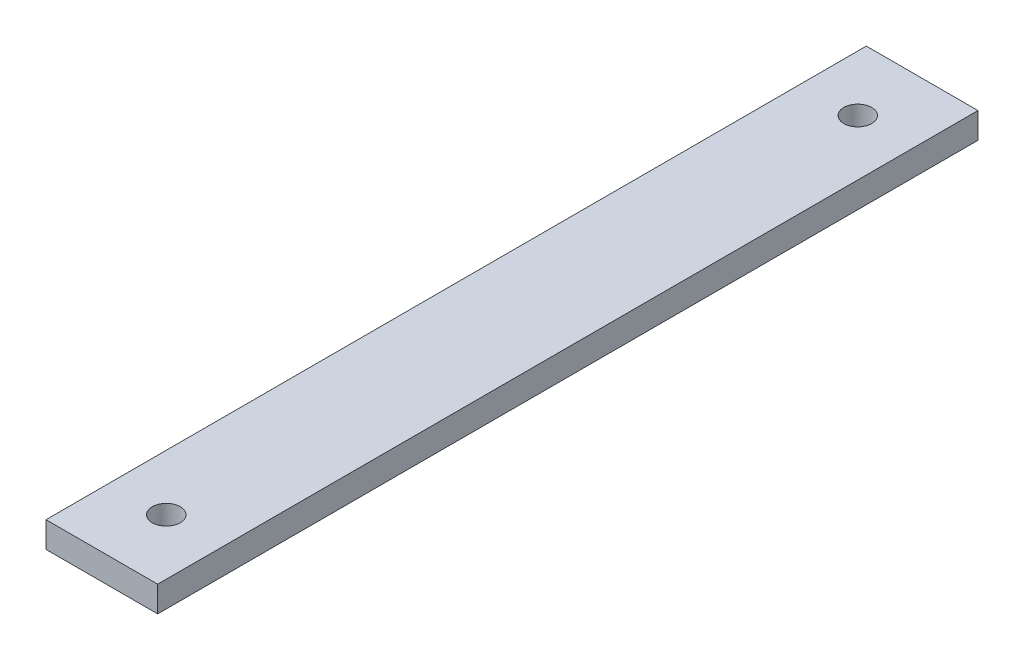
from build123d import *

# Parameters (mm, degrees)
SKETCH1_W           = 26
SKETCH1_H           = 191
BOSS_EXTRUDE1_DEPTH = 6
SKETCH2_R           = 3.25
CUT_EXTRUDE1_DEPTH  = 10


with BuildPart() as part:
    # Sketch1 → Boss-Extrude1 (new body)
    with BuildSketch(Plane(origin=(0, 0, 0), x_dir=(1, 0, 0), z_dir=(0, 1, 0))):
        with Locations((-63.236527651, -51.045128746)):
            Rectangle(SKETCH1_W, SKETCH1_H)
    extrude(amount=BOSS_EXTRUDE1_DEPTH)

    # Sketch2 → Cut-Extrude1 (cut)
    with BuildSketch(Plane(origin=(0, 0, 0), x_dir=(-1, 0, 0), z_dir=(0, -1, 0))):
        with Locations(Location((63.236527651, -131.545128746, 0), (0, 0, 90))):
            Circle(SKETCH2_R)
        with Locations(Location((63.236527651, 29.454871254, 0), (0, 0, 90))):
            Circle(SKETCH2_R)
    extrude(amount=-CUT_EXTRUDE1_DEPTH, mode=Mode.SUBTRACT)


solid = part.part
